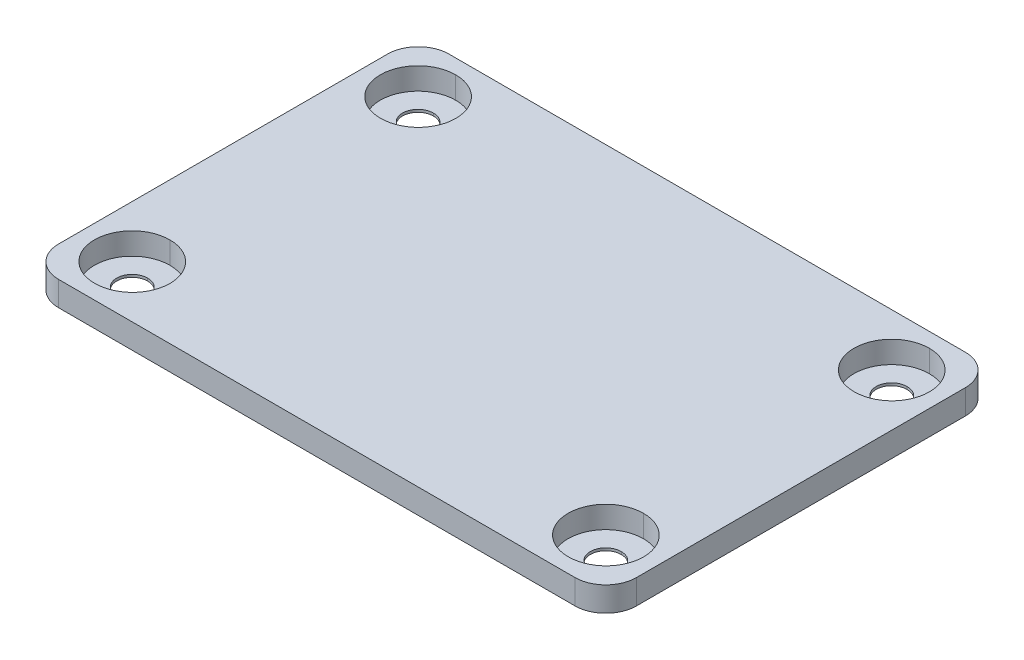
from build123d import *

# Parameters (mm, degrees)
SKETCH1_W                                    = 94
SKETCH1_H                                    = 63.5
BOSS_EXTRUDE1_DEPTH                          = 4
CBORE_SLOT_FOR_M5_HEX_HEAD_BOLT1_D           = 5
CBORE_SLOT_FOR_M5_HEX_HEAD_BOLT1_DEPTH       = 18
CBORE_SLOT_FOR_M5_HEX_HEAD_BOLT1_CBORE_D     = 12.24
CBORE_SLOT_FOR_M5_HEX_HEAD_BOLT1_CBORE_DEPTH = 3.58
CBORE_SLOT_FOR_M5_HEX_HEAD_BOLT1_TIP         = 1.502151548
FILLET1_R                                    = 5


with BuildPart() as part:
    # Sketch1 → Boss-Extrude1 (new body)
    with BuildSketch(Plane(origin=(0, 0, 0), x_dir=(1, 0, 0), z_dir=(0, 1, 0))):
        with Locations((12.203186111, 24.532883045)):
            Rectangle(SKETCH1_W, SKETCH1_H)
    extrude(amount=BOSS_EXTRUDE1_DEPTH)

    # CBORE SLOT for M5 Hex Head Bolt1
    with Locations(Plane(origin=(0, 4, 0), x_dir=(1, 0, 0), z_dir=(0, 1, 0))):
        with Locations((-26.296813889, 47.782883045), (-26.296813889, 1.282883045), (50.753186111, 47.782883045), (50.753186111, 1.282883045), (-26.346813889, 47.782883045), (-26.346813889, 1.282883045), (50.703186111, 1.282883045), (50.703186111, 47.782883045)):
            CounterBoreHole(CBORE_SLOT_FOR_M5_HEX_HEAD_BOLT1_D / 2, CBORE_SLOT_FOR_M5_HEX_HEAD_BOLT1_CBORE_D / 2, CBORE_SLOT_FOR_M5_HEX_HEAD_BOLT1_CBORE_DEPTH, depth=CBORE_SLOT_FOR_M5_HEX_HEAD_BOLT1_DEPTH)
            with Locations((0, 0, -(CBORE_SLOT_FOR_M5_HEX_HEAD_BOLT1_DEPTH + CBORE_SLOT_FOR_M5_HEX_HEAD_BOLT1_TIP / 2))):  # 118° drill point
                Cone(0, CBORE_SLOT_FOR_M5_HEX_HEAD_BOLT1_D / 2, CBORE_SLOT_FOR_M5_HEX_HEAD_BOLT1_TIP, mode=Mode.SUBTRACT)

    # Fillet1
    fillet1_edges = [part.edges().sort_by_distance(p)[0] for p in [
        (-34.796813889, 2, -56.282883045),
        (59.203186111, 2, -56.282883045),
        (59.203186111, 2, 7.217116955),
        (-34.796813889, 2, 7.217116955),
    ]]
    fillet(fillet1_edges, radius=FILLET1_R)


solid = part.part
